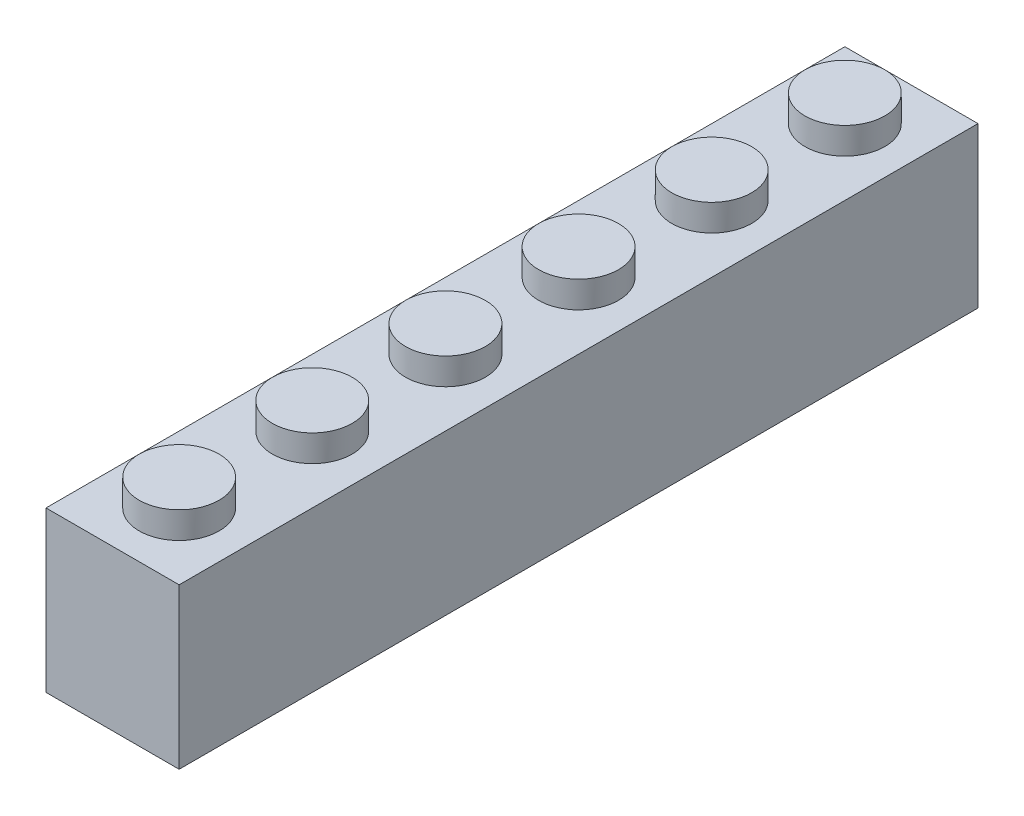
from build123d import *

# Parameters (mm, degrees)
SKETCH1_W            = 8
SKETCH1_H            = 48
BOSS_EXTRUDE1_DEPTH  = 9.6
SKETCH2_R            = 2.4
BOSS_EXTRUDE2_DEPTH  = 1.6
LPATTERN1_COUNT      = 2
LPATTERN1_PITCH      = 8
LPATTERN1_COUNT_DIR2 = 6
LPATTERN1_PITCH_DIR2 = 8
SHELL1_T             = -1.6


with BuildPart() as part:
    # Sketch1 → Boss-Extrude1 (new body)
    with BuildSketch(Plane(origin=(0, 0, 0), x_dir=(1, 0, 0), z_dir=(0, 1, 0))):
        with Locations((4, 24)):
            Rectangle(SKETCH1_W, SKETCH1_H)
    extrude(amount=BOSS_EXTRUDE1_DEPTH)

    # Sketch2 → Boss-Extrude2 (add)
    with BuildSketch(Plane(origin=(0, 9.6, 0), x_dir=(1, 0, 0), z_dir=(0, 1, 0))):
        with Locations(Location((4, 4, 0), (0, 0, 90))):
            Circle(SKETCH2_R)
    boss_extrude2 = extrude(amount=BOSS_EXTRUDE2_DEPTH)

    # LPattern1: Boss-Extrude2 2 × 6, 6 skipped
    with Locations(*[(i * LPATTERN1_PITCH, 0, -j * LPATTERN1_PITCH_DIR2) for i in range(LPATTERN1_COUNT) for j in range(LPATTERN1_COUNT_DIR2) if (i, j) not in ((0, 0), (1, 0), (1, 1), (1, 2), (1, 3), (1, 4), (1, 5))]):
        add(boss_extrude2)

    # Shell1
    shell1_openings = [part.faces().sort_by_distance(p)[0] for p in [
        (4, 0, -24),
    ]]
    offset(amount=SHELL1_T, openings=shell1_openings, kind=Kind.INTERSECTION)


solid = part.part
